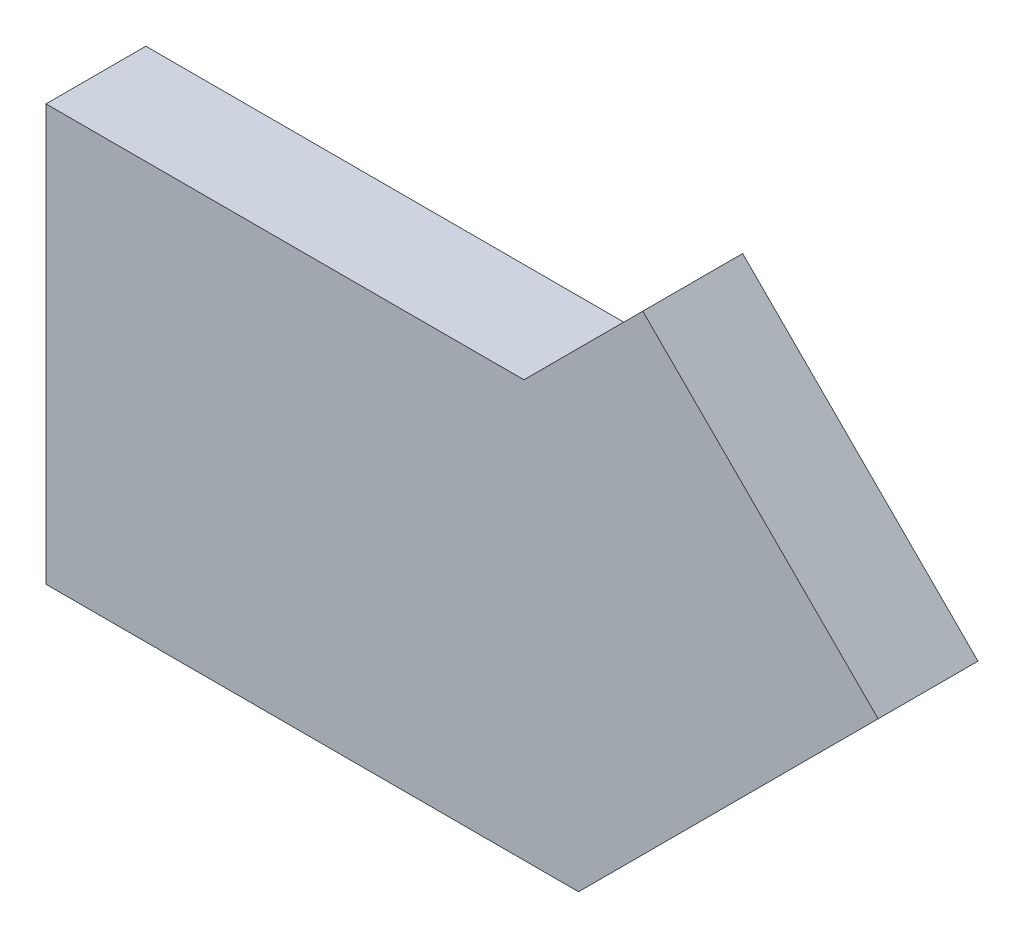
from build123d import *

# Parameters (mm, degrees)
EXTRUDE_1_DEPTH = 6


with BuildPart() as part:
    # 草圖1 → 填料-伸長1 (new body)
    with BuildSketch(Plane.XY):
        Polygon((0, 0), (32, 0), (50, 18), (35.857864376, 32.142135624), (28.715728753, 25), (0, 25), align=None)
    extrude(amount=EXTRUDE_1_DEPTH)


solid = part.part
